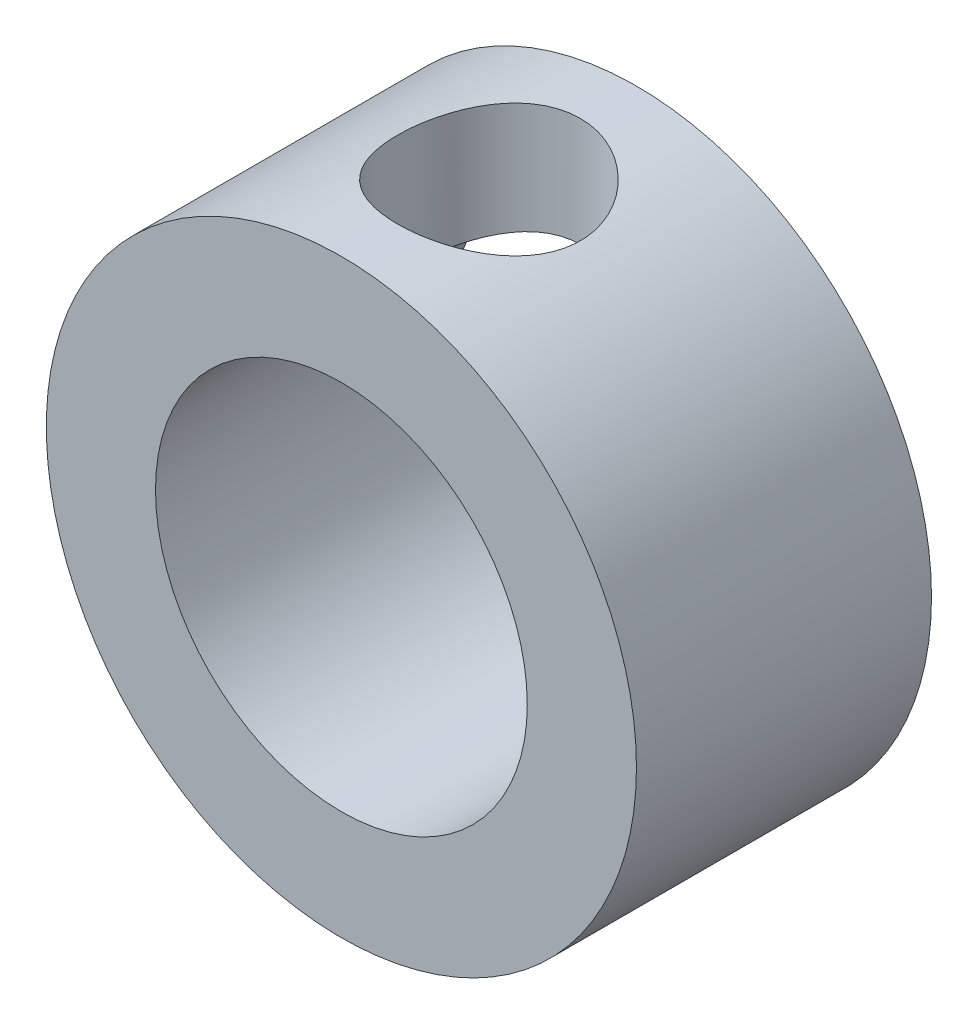
from build123d import *

# Parameters (mm, degrees)
SKETCH1_R               = 12.7
SKETCH1_R_2             = 8.001
BOSS_EXTRUDE1_DEPTH     = 12.7
CUT_EXTRUDE1_REACH      = 33.109
CUT_EXTRUDE1_END_RADIUS = 8.001
SKETCH2_R               = 3.937


with BuildPart() as part:
    # Sketch1 → Boss-Extrude1 (new body)
    with BuildSketch(Plane.XY):
        Circle(SKETCH1_R)
        Circle(SKETCH1_R_2, mode=Mode.SUBTRACT)
    extrude(amount=BOSS_EXTRUDE1_DEPTH)

    # Cut-Extrude1: up to this cylinder (the profile starts outside it)
    cut_extrude1_end = Plane(origin=(0, 0, 6.35), z_dir=(0, 0, -1)) * Cylinder(CUT_EXTRUDE1_END_RADIUS, 83.22, mode=Mode.PRIVATE)
    # Sketch2 → Cut-Extrude1 (cut, up to the surface)
    with BuildSketch(Plane(origin=(0, 12.7, 0), x_dir=(1, 0, 0), z_dir=(0, 1, 0)), mode=Mode.PRIVATE) as cut_extrude1_sk1:
        with Locations(Location((0, -6.35, 0), (0, 0, 270))):
            Circle(SKETCH2_R)
    cut_extrude1_tool1 = extrude(cut_extrude1_sk1.sketch, amount=-CUT_EXTRUDE1_REACH, mode=Mode.PRIVATE) - cut_extrude1_end
    add(cut_extrude1_tool1.solids().sort_by_distance((0, 12.7, 6.35))[0], mode=Mode.SUBTRACT)


solid = part.part
